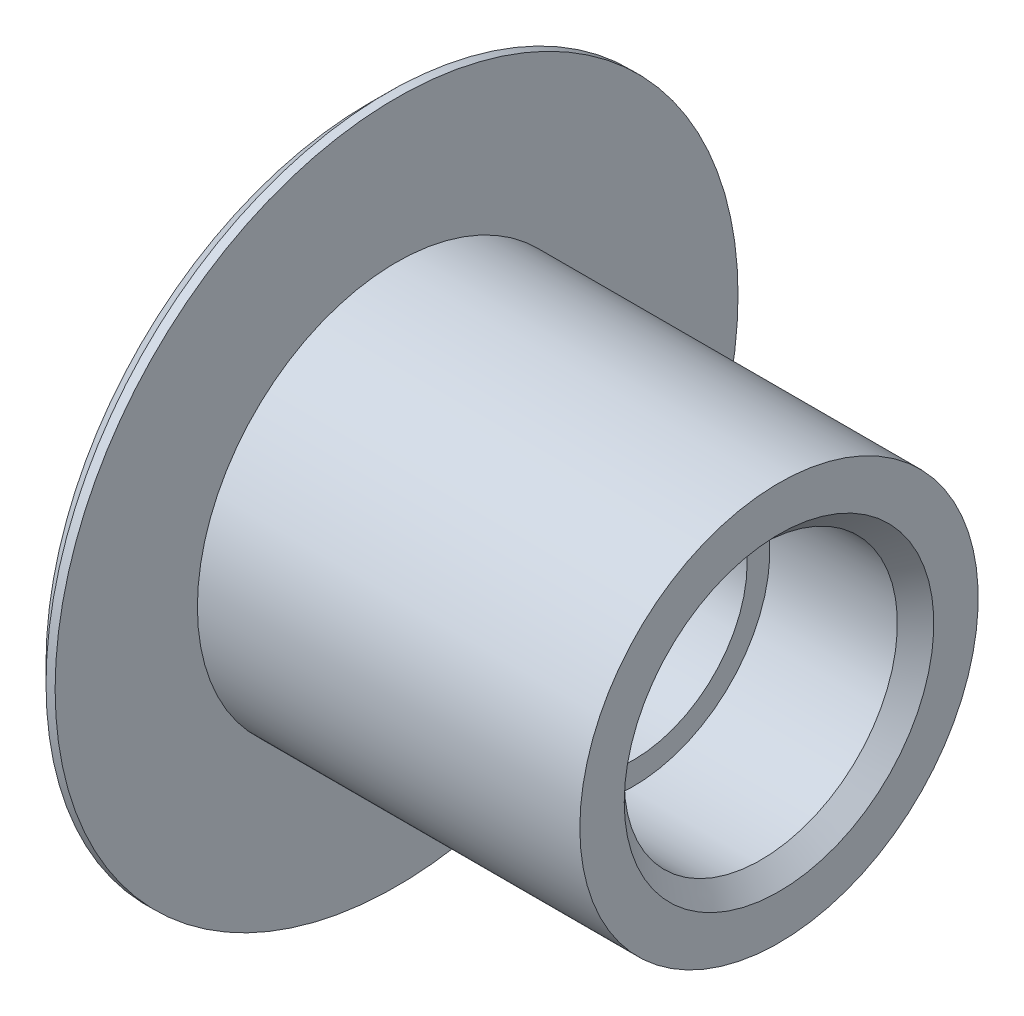
from build123d import *

# Parameters (mm, degrees)
CHAMFER1_SIZE = 0.508


with BuildPart() as part:
    # Sketch1 → Revolve1 (revolve)
    with BuildSketch(Plane.XY, mode=Mode.PRIVATE) as revolve1_sk:
        Polygon((-38.510306737, 2.281775494), (-37.748306737, 2.281775494), (-37.748306737, -1.686974506), (-33.430306737, -1.686974506), (-27.080306737, -1.686974506), (-27.080306737, -3.433224506), (-31.144306737, -3.433224506), (-31.144306737, -4.068224506), (-38.510306737, -4.068224506), align=None)
    revolve(revolve1_sk.sketch.rotate(Axis((-27.588306737, -7.243224506, 0), (1, 0, 0)), 90), axis=Axis((-27.588306737, -7.243224506, 0), (1, 0, 0)))

    # Chamfer1
    chamfer1_edges = [part.edges().sort_by_distance(p)[0] for p in [
        (-38.510306737, -7.243224506, -3.175),
        (-38.510306737, -7.243224506, -9.525),
        (-27.080306737, -7.243224506, -3.81),
    ]]
    chamfer(chamfer1_edges, length=CHAMFER1_SIZE)


solid = part.part
